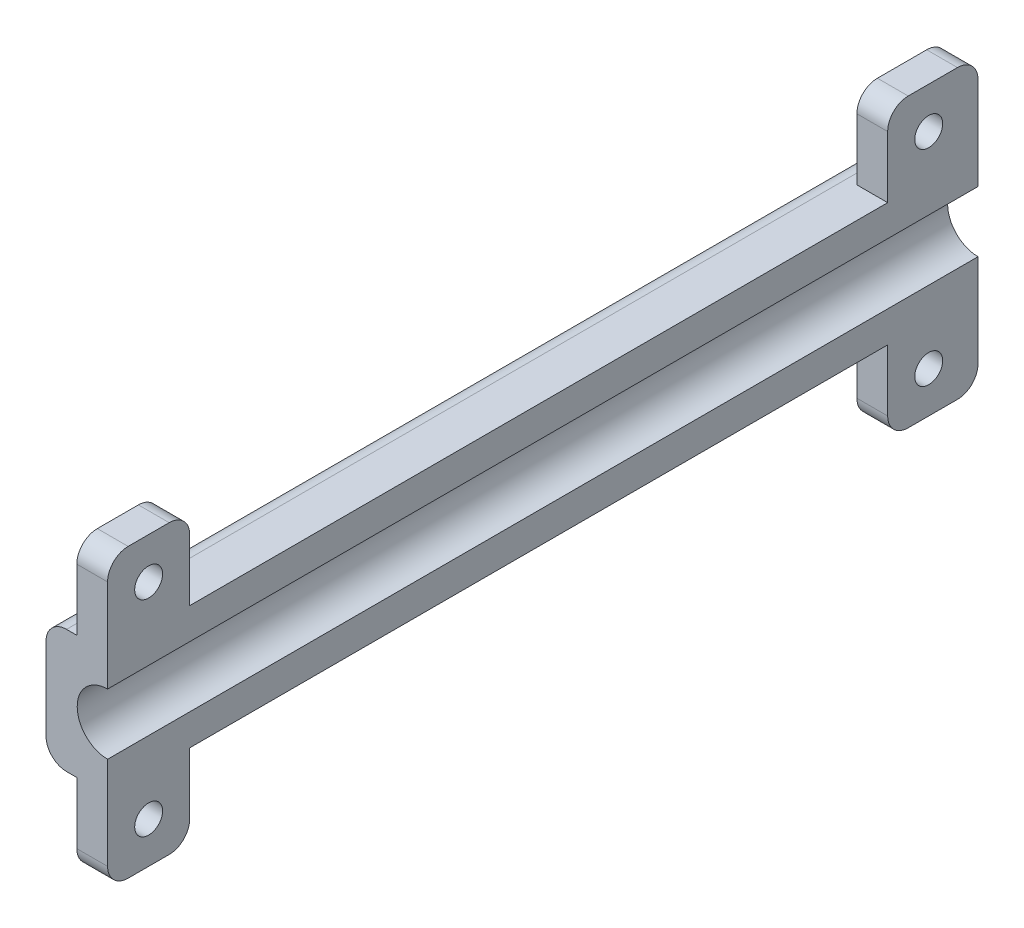
from build123d import *

# Parameters (mm, degrees)
BOSS_EXTRUDE1_DEPTH = 106
SKETCH3_R           = 1.7
BOSS_EXTRUDE2_DEPTH = 3.75
FILLET1_R           = 2.5


with BuildPart() as part:
    # Sketch2 → Boss-Extrude1 (new body)
    with BuildSketch(Plane.XY):
        with BuildLine():
            Line((2.75, 11.2), (2.75, 15))
            Line((2.75, 15), (-4.75, 15))
            Line((-4.75, 15), (-4.75, 0))
            Line((-4.75, 0), (2.75, 0))
            Line((2.75, 0), (2.75, 3.8))
            ThreePointArc((2.75, 3.8), (-0.95, 7.5), (2.75, 11.2))
        make_face()
    extrude(amount=-BOSS_EXTRUDE1_DEPTH)

    # Sketch3 → Boss-Extrude2 (add)
    # profile 1 of 2: a face of its own
    with BuildSketch(Plane.ZY.offset(-2.75)):
        with BuildLine():
            Line((-103.5, -10), (-97.5, -10))
            ThreePointArc((-97.5, -10), (-95.732233047, -9.267766953), (-95, -7.5))
            Line((-95, -7.5), (-95, 0))
            Line((-95, 0), (-10, 0))
            Line((-10, 0), (-10, -7.5))
            ThreePointArc((-10, -7.5), (-9.267766953, -9.267766953), (-7.5, -10))
            Line((-7.5, -10), (-2.5, -10))
            ThreePointArc((-2.5, -10), (-0.732233047, -9.267766953), (0, -7.5))
            Line((0, -7.5), (0, 3.8))
            Line((0, 3.8), (-106, 3.8))
            Line((-106, 3.8), (-106, -7.5))
            ThreePointArc((-106, -7.5), (-105.267766953, -9.267766953), (-103.5, -10))
        make_face()
        with Locations((-5, -5)):
            Circle(SKETCH3_R, mode=Mode.SUBTRACT)
        with Locations((-100, -5)):
            Circle(SKETCH3_R, mode=Mode.SUBTRACT)
    # profile 2 of 2: a face of its own
    with BuildSketch(Plane.ZY.offset(-2.75)):
        with BuildLine():
            Line((-106, 11.2), (0, 11.2))
            Line((0, 11.2), (0, 22.5))
            ThreePointArc((0, 22.5), (-0.732233047, 24.267766953), (-2.5, 25))
            Line((-2.5, 25), (-7.5, 25))
            ThreePointArc((-7.5, 25), (-9.267766953, 24.267766953), (-10, 22.5))
            Line((-10, 22.5), (-10, 15))
            Line((-10, 15), (-95, 15))
            Line((-95, 15), (-95, 22.5))
            ThreePointArc((-95, 22.5), (-95.732233047, 24.267766953), (-97.5, 25))
            Line((-97.5, 25), (-103.5, 25))
            ThreePointArc((-103.5, 25), (-105.267766953, 24.267766953), (-106, 22.5))
            Line((-106, 22.5), (-106, 11.2))
        make_face()
        with Locations((-5, 20)):
            Circle(SKETCH3_R, mode=Mode.SUBTRACT)
        with Locations((-100, 20)):
            Circle(SKETCH3_R, mode=Mode.SUBTRACT)
    extrude(amount=BOSS_EXTRUDE2_DEPTH)

    # Fillet1
    fillet1_edges = [part.edges().sort_by_distance(p)[0] for p in [
        (-4.75, 0, -53),
        (-4.75, 15, -53),
    ]]
    fillet(fillet1_edges, radius=FILLET1_R)


solid = part.part
